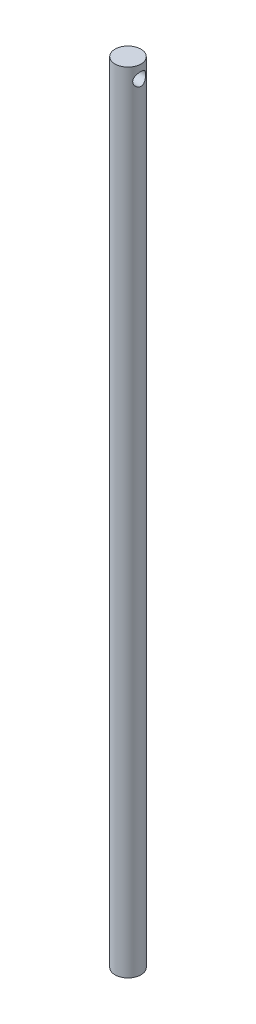
from build123d import *

# Parameters (mm, degrees)
SKETCH1_R               = 3.175
BOSS_EXTRUDE1_DEPTH     = 193.675
CUT_EXTRUDE1_DEPTH      = 9.398
CUT_EXTRUDE1_DEPTH_BACK = 9.652
SKETCH2_R               = 1.5875


with BuildPart() as part:
    # Sketch1 → Boss-Extrude1 (new body)
    with BuildSketch(Plane(origin=(0, 0, 0), x_dir=(1, 0, 0), z_dir=(0, 1, 0))):
        with Locations(Location((0, 0, 0), (0, 0, 270))):
            Circle(SKETCH1_R)
    extrude(amount=BOSS_EXTRUDE1_DEPTH)

    # Sketch2 → Cut-Extrude1 (cut, two sides: drawn at the far end of the back side and taken through both)
    with BuildSketch(Plane(origin=(0, 0, 0), x_dir=(0, 0, -1), z_dir=(1, 0, 0)).offset(-CUT_EXTRUDE1_DEPTH_BACK)):
        with Locations(Location((0, 190.5, 0), (0, 0, 180))):
            Circle(SKETCH2_R)
    extrude(amount=CUT_EXTRUDE1_DEPTH + CUT_EXTRUDE1_DEPTH_BACK, mode=Mode.SUBTRACT)


solid = part.part
